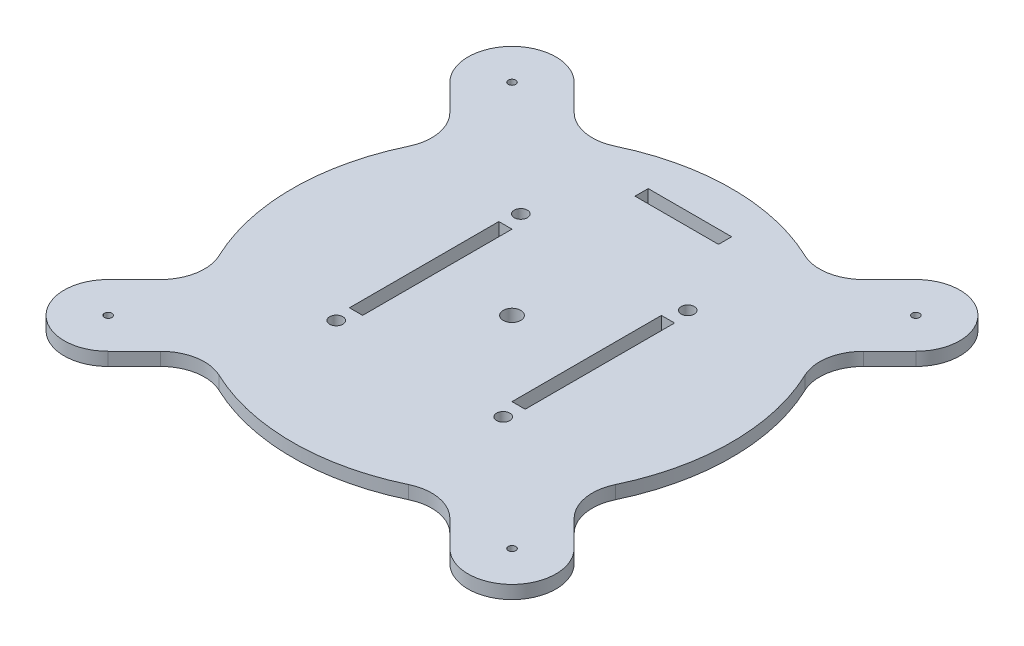
from build123d import *

# Parameters (mm, degrees)
ESQUISSE1_R        = 0.85
ESQUISSE1_R_2      = 1.5
ESQUISSE1_R_3      = 2
ESQUISSE1_W        = 3
ESQUISSE1_H        = 34
ESQUISSE1_W_2      = 19
ESQUISSE1_H_2      = 3
BOSS_EXTRU_1_DEPTH = 3
CONG_1_R           = 10


with BuildPart() as part:
    # Esquisse1 → Boss.-Extru.1 (new body)
    with BuildSketch(Plane(origin=(0, 0, 0), x_dir=(1, 0, 0), z_dir=(0, 1, 0))):
        with BuildLine():
            Line((-38.890872965, -53.033008589), (-27.56994834, -41.712083963))
            ThreePointArc((-27.56994834, -41.712083963), (0, -50), (27.56994834, -41.712083963))
            Line((27.56994834, -41.712083963), (38.890872965, -53.033008589))
            ThreePointArc((38.890872965, -53.033008589), (53.033008589, -53.033008589), (53.033008589, -38.890872965))
            Line((53.033008589, -38.890872965), (41.712083963, -27.56994834))
            ThreePointArc((41.712083963, -27.56994834), (50, 0), (41.712083963, 27.56994834))
            Line((41.712083963, 27.56994834), (53.033008589, 38.890872965))
            ThreePointArc((53.033008589, 38.890872965), (53.033008589, 53.033008589), (38.890872965, 53.033008589))
            Line((38.890872965, 53.033008589), (27.56994834, 41.712083963))
            ThreePointArc((27.56994834, 41.712083963), (0, 50), (-27.56994834, 41.712083963))
            Line((-27.56994834, 41.712083963), (-38.890872965, 53.033008589))
            ThreePointArc((-38.890872965, 53.033008589), (-53.033008589, 53.033008589), (-53.033008589, 38.890872965))
            Line((-53.033008589, 38.890872965), (-41.712083963, 27.56994834))
            ThreePointArc((-41.712083963, 27.56994834), (-50, 0), (-41.712083963, -27.56994834))
            Line((-41.712083963, -27.56994834), (-53.033008589, -38.890872965))
            ThreePointArc((-53.033008589, -38.890872965), (-53.033008589, -53.033008589), (-38.890872965, -53.033008589))
        make_face()
        with Locations(Location((-45.961940777, -45.961940777, 0), (0, 0, 270))):
            Circle(ESQUISSE1_R, mode=Mode.SUBTRACT)
        with Locations(Location((-45.961940777, 45.961940777, 0), (0, 0, 270))):
            Circle(ESQUISSE1_R, mode=Mode.SUBTRACT)
        with Locations(Location((45.961940777, 45.961940777, 0), (0, 0, 270))):
            Circle(ESQUISSE1_R, mode=Mode.SUBTRACT)
        with Locations(Location((45.961940777, -45.961940777, 0), (0, 0, 270))):
            Circle(ESQUISSE1_R, mode=Mode.SUBTRACT)
        with Locations(Location((-19, 21, 0), (0, 0, 270))):
            Circle(ESQUISSE1_R_2, mode=Mode.SUBTRACT)
        with Locations(Location((19, 21, 0), (0, 0, 270))):
            Circle(ESQUISSE1_R_2, mode=Mode.SUBTRACT)
        with Locations(Location((19, -21, 0), (0, 0, 270))):
            Circle(ESQUISSE1_R_2, mode=Mode.SUBTRACT)
        with Locations(Location((-19, -21, 0), (0, 0, 270))):
            Circle(ESQUISSE1_R_2, mode=Mode.SUBTRACT)
        with Locations(Location((0, 0, 0), (0, 0, 270))):
            Circle(ESQUISSE1_R_3, mode=Mode.SUBTRACT)
        with Locations((-18.5, 0)):
            Rectangle(ESQUISSE1_W, ESQUISSE1_H, mode=Mode.SUBTRACT)
        with Locations((18.5, 0)):
            Rectangle(ESQUISSE1_W, ESQUISSE1_H, mode=Mode.SUBTRACT)
        with Locations((0, 39)):
            Rectangle(ESQUISSE1_W_2, ESQUISSE1_H_2, mode=Mode.SUBTRACT)
    extrude(amount=BOSS_EXTRU_1_DEPTH)

    # Congé1
    cong_1_edges = [part.edges().sort_by_distance(p)[0] for p in [
        (-27.56994834, 1.5, 41.712083963),
        (-41.712083963, 1.5, 27.56994834),
        (-41.712083963, 1.5, -27.56994834),
        (-27.56994834, 1.5, -41.712083963),
        (27.56994834, 1.5, -41.712083963),
        (41.712083963, 1.5, -27.56994834),
        (41.712083963, 1.5, 27.56994834),
        (27.56994834, 1.5, 41.712083963),
    ]]
    fillet(cong_1_edges, radius=CONG_1_R)


solid = part.part
